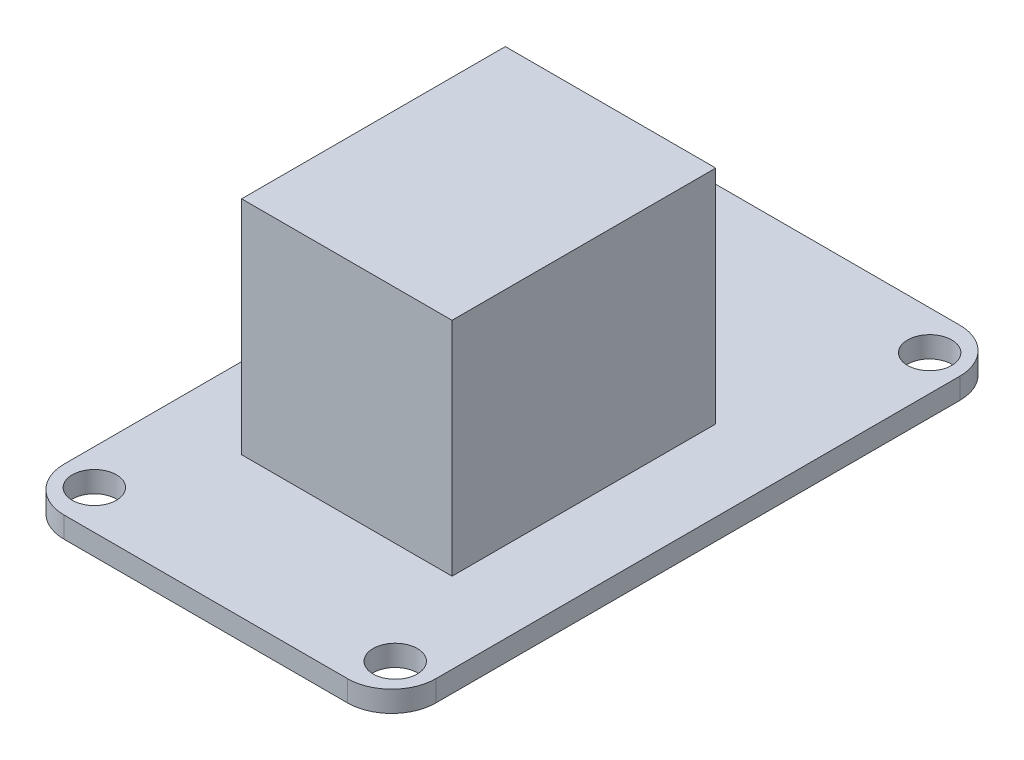
from build123d import *

# Parameters (mm, degrees)
SKETCH1_W           = 26.5
SKETCH1_H           = 43.65
BOSS_EXTRUDE1_DEPTH = 1.5
FILLET1_R           = 3.15
SKETCH2_R           = 1.575
CUT_EXTRUDE1_DEPTH  = 1.5
SKETCH3_W           = 15
SKETCH3_H           = 18.8
BOSS_EXTRUDE2_DEPTH = 15.8


with BuildPart() as part:
    # Sketch1 → Boss-Extrude1 (new body)
    with BuildSketch(Plane(origin=(0, 0, 0), x_dir=(1, 0, 0), z_dir=(0, 1, 0))):
        Rectangle(SKETCH1_W, SKETCH1_H)
    extrude(amount=BOSS_EXTRUDE1_DEPTH)

    # Fillet1
    fillet1_edges = [part.edges().sort_by_distance(p)[0] for p in [
        (-13.25, 0.75, -21.825),
        (13.25, 0.75, -21.825),
        (13.25, 0.75, 21.825),
        (-13.25, 0.75, 21.825),
    ]]
    fillet(fillet1_edges, radius=FILLET1_R)

    # Sketch2 → Cut-Extrude1 (cut)
    with BuildSketch(Plane(origin=(0, 1.5, 0), x_dir=(1, 0, 0), z_dir=(0, 1, 0))):
        with Locations(Location((-10.725, 19.05, 0), (0, 0, 270))):
            Circle(SKETCH2_R)
        with Locations(Location((10.725, 19.05, 0), (0, 0, 270))):
            Circle(SKETCH2_R)
        with Locations(Location((10.725, -19.05, 0), (0, 0, 270))):
            Circle(SKETCH2_R)
        with Locations(Location((-10.725, -19.05, 0), (0, 0, 270))):
            Circle(SKETCH2_R)
    extrude(amount=-CUT_EXTRUDE1_DEPTH, mode=Mode.SUBTRACT)

    # Sketch3 → Boss-Extrude2 (add)
    with BuildSketch(Plane(origin=(0, 1.5, 0), x_dir=(1, 0, 0), z_dir=(0, 1, 0))):
        with Locations((0, -2.375)):
            Rectangle(SKETCH3_W, SKETCH3_H)
    extrude(amount=BOSS_EXTRUDE2_DEPTH)


solid = part.part
